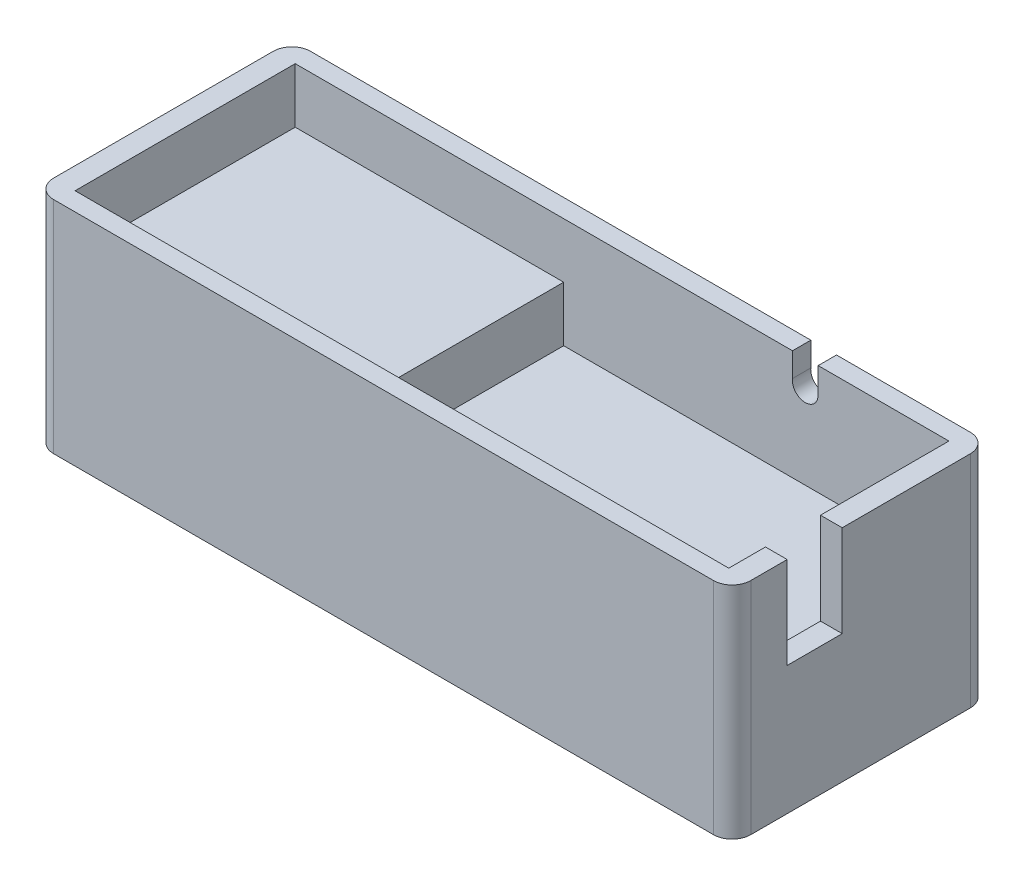
from build123d import *

# Parameters (mm, degrees)
SKETCH1_W           = 190
SKETCH1_H           = 70
BOSS_EXTRUDE1_DEPTH = 60
SKETCH2_W           = 178.169104448
SKETCH2_H           = 60
CUT_EXTRUDE1_DEPTH  = 50
FILLET2_R           = 5.08
SKETCH5_R           = 3.5
CUT_EXTRUDE3_DEPTH  = 11.210906631
SKETCH6_W           = 179.69669377
SKETCH6_H           = 60
BOSS_EXTRUDE3_DEPTH = 20
SKETCH7_W           = 15
SKETCH7_H           = 33.02
CUT_EXTRUDE4_DEPTH  = 16.51
SKETCH9_W           = 7
SKETCH9_H           = 5
CUT_EXTRUDE5_DEPTH  = 6.929984537
SKETCH11_W          = 91
SKETCH11_H          = 59
CUT_EXTRUDE6_DEPTH  = 17
SKETCH13_W          = 21.297722751
SKETCH13_H          = 5.714951011
CUT_EXTRUDE7_DEPTH  = 26.645395744
SKETCH16_W          = 73.169104448
SKETCH16_H          = 60
BOSS_EXTRUDE9_DEPTH = 15


with BuildPart() as part:
    # Sketch1 → Boss-Extrude1 (new body)
    with BuildSketch(Plane(origin=(0, 0, 0), x_dir=(1, 0, 0), z_dir=(0, 1, 0))):
        Rectangle(SKETCH1_W, SKETCH1_H)
    extrude(amount=BOSS_EXTRUDE1_DEPTH)

    # Sketch2 → Cut-Extrude1 (cut)
    with BuildSketch(Plane(origin=(0, 60, 0), x_dir=(1, 0, 0), z_dir=(0, 1, 0))):
        Rectangle(SKETCH2_W, SKETCH2_H)
    extrude(amount=-CUT_EXTRUDE1_DEPTH, mode=Mode.SUBTRACT)

    # Fillet2
    fillet2_edges = [part.edges().sort_by_distance(p)[0] for p in [
        (-95, 30, -35),
        (95, 30, -35),
        (95, 30, 35),
        (-95, 30, 35),
    ]]
    fillet(fillet2_edges, radius=FILLET2_R)

    # Sketch5 → Cut-Extrude3 (cut)
    with BuildSketch(Plane(origin=(0, 0, -35), x_dir=(-1, 0, 0), z_dir=(0, 0, -1))):
        with Locations((-49.92, 53)):
            Circle(SKETCH5_R)
    extrude(amount=-CUT_EXTRUDE3_DEPTH, mode=Mode.SUBTRACT)

    # Sketch6 → Boss-Extrude3 (add)
    with BuildSketch(Plane(origin=(0, 10, 0), x_dir=(1, 0, 0), z_dir=(0, 1, 0))):
        with Locations((-0.763794661, 0)):
            Rectangle(SKETCH6_W, SKETCH6_H)
    extrude(amount=BOSS_EXTRUDE3_DEPTH)

    # Sketch7 → Cut-Extrude4 (cut)
    with BuildSketch(Plane.ZY.offset(-89.084552224)):
        with Locations((12.5, 51.51)):
            Rectangle(SKETCH7_W, SKETCH7_H)
    extrude(amount=-CUT_EXTRUDE4_DEPTH, mode=Mode.SUBTRACT)

    # Sketch9 → Cut-Extrude5 (cut)
    with BuildSketch(Plane(origin=(4.741106384, 60, 0), x_dir=(1, 0, 0), z_dir=(0, 1, 0))):
        with Locations((45.208400252, 32.5)):
            Rectangle(SKETCH9_W, SKETCH9_H)
    extrude(amount=-CUT_EXTRUDE5_DEPTH, mode=Mode.SUBTRACT)

    # Sketch11 → Cut-Extrude6 (cut)
    with BuildSketch(Plane.XZ):
        with Locations((-37.248482646, 0)):
            Rectangle(SKETCH11_W, SKETCH11_H)
    extrude(amount=-CUT_EXTRUDE6_DEPTH, mode=Mode.SUBTRACT)

    # Sketch13 → Cut-Extrude7 (cut)
    with BuildSketch(Plane.XZ.offset(-17)):
        with Locations((-2.397344022, 29.141507707)):
            Rectangle(SKETCH13_W, SKETCH13_H)
    extrude(amount=-CUT_EXTRUDE7_DEPTH, mode=Mode.SUBTRACT)

    # Sketch16 → Boss-Extrude9 (add)
    with BuildSketch(Plane(origin=(0, 30, 0), x_dir=(1, 0, 0), z_dir=(0, 1, 0))):
        with Locations((-52.5, 0)):
            Rectangle(SKETCH16_W, SKETCH16_H)
    extrude(amount=BOSS_EXTRUDE9_DEPTH)


solid = part.part
